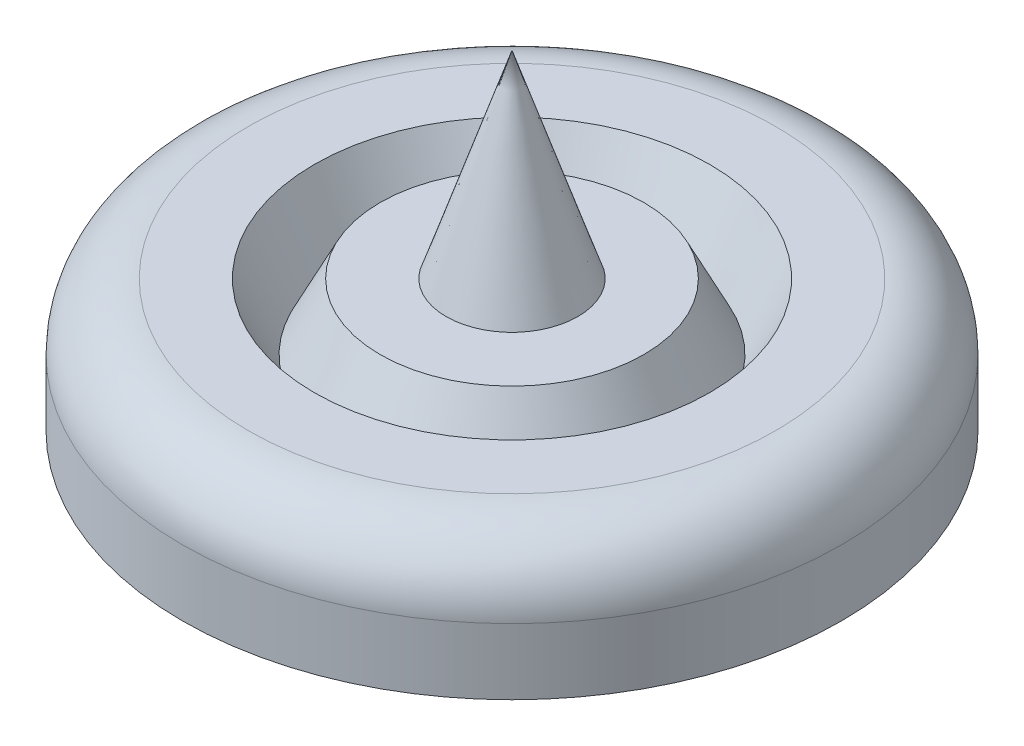
from build123d import *


with BuildPart() as part:
    # Sketch6 → Revolve1 (revolve)
    with BuildSketch(Plane.XY, mode=Mode.PRIVATE) as revolve1_sk:
        with BuildLine():
            Line((0, 25.4), (25.4, 0))
            Line((25.4, 0), (127, 0))
            Line((127, 0), (127, 25.4))
            ThreePointArc((127, 25.4), (119.560512242, 43.360512242), (101.6, 50.8))
            Line((101.6, 50.8), (76.2, 50.8))
            Line((76.2, 50.8), (63.5, 25.4))
            Line((63.5, 25.4), (50.8, 50.8))
            Line((50.8, 50.8), (25.4, 50.8))
            Line((25.4, 50.8), (0, 127))
            Line((0, 127), (0, 25.4))
        make_face()
    revolve(revolve1_sk.sketch.rotate(Axis((0, 127, 0), (0, -1, 0)), 90), axis=Axis((0, 127, 0), (0, -1, 0)))


solid = part.part
